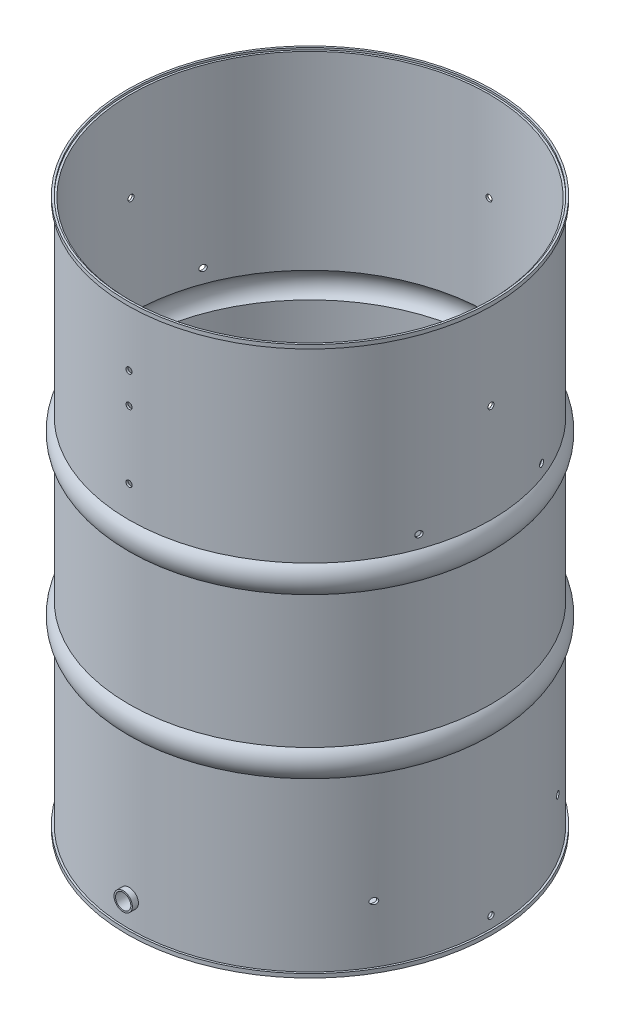
from build123d import *

# Parameters (mm, degrees)
SKETCH2_R                     = 15
BOSS_EXTRUDE1_DEPTH           = 304.8
SKETCH4_R                     = 12.5
AIR_INLET_HOLE_DEPTH          = 303.464
SKETCH5_R                     = 253.021217874
SWEEP_CUT_FOR_AIR_INLET_DEPTH = 76.2
SKETCH6_R                     = 75
COAL_SHUTE_HOLE_DEPTH         = 1181.002884092
WATER_PAN_HOLES_DEPTH         = 1181.002884092
WATER_PAN_HOLES_DEPTH_BACK    = 1181.002884092
SKETCH7_R                     = 5
GRILL_HOLE_1_DEPTH            = 1181.002884092
GRILL_HOLE_1_DEPTH_BACK       = 1181.002884092
SKETCH8_R                     = 5
GRILL_HOLE_2_DEPTH            = 1181.002884092
GRILL_HOLE_2_DEPTH_BACK       = 1181.002884092
SKETCH9_R                     = 5
COAL_BASKET_HOLES_DEPTH       = 1181.002884092
COAL_BASKET_HOLES_DEPTH_BACK  = 1181.002884092
SKETCH10_R                    = 5
AIR_SPREADER_HOLE_DEPTH       = 1181.002884092
AIR_SPREADER_HOLE_DEPTH_BACK  = 1181.002884092
SKETCH11_R                    = 5
SKETCH12_R                    = 5
BRACKET_HOLES_DEPTH           = 1181.002884092


with BuildPart() as part:
    # Sketch1 → Revolve1 (revolve)
    with BuildSketch(Plane.XY, mode=Mode.PRIVATE) as revolve1_sk:
        with BuildLine():
            Line((292.1, 206.565437082), (0, 206.565437082))
            Line((0, 206.565437082), (0, 203.390437082))
            Line((0, 203.390437082), (298.45, 203.390437082))
            Line((298.45, 203.390437082), (298.45, 209.740437082))
            Line((298.45, 209.740437082), (295.275, 209.740437082))
            Line((295.275, 209.740437082), (295.275, 482.790437082))
            ThreePointArc((295.275, 482.790437082), (304.416244366, 504.859353208), (295.275, 526.928269334))
            Line((295.275, 526.928269334), (295.275, 742.828269334))
            ThreePointArc((295.275, 742.828269334), (304.503227722, 765.107181856), (295.275, 787.386094378))
            Line((295.275, 787.386094378), (295.275, 1092.186094378))
            Line((295.275, 1092.186094378), (298.45, 1092.186094378))
            Line((298.45, 1092.186094378), (298.45, 1098.536094378))
            Line((298.45, 1098.536094378), (295.275, 1098.536094378))
            Line((295.275, 1098.536094378), (295.275, 1095.361094378))
            Line((295.275, 1095.361094378), (292.1, 1095.361094378))
            Line((292.1, 1095.361094378), (292.1, 786.029674468))
            ThreePointArc((292.1, 786.029674468), (301.328227722, 765.107181856), (292.1, 744.184689243))
            Line((292.1, 744.184689243), (292.1, 525.571430777))
            ThreePointArc((292.1, 525.571430777), (301.241244366, 504.859353208), (292.1, 484.147275638))
            Line((292.1, 484.147275638), (292.1, 206.565437082))
        make_face()
    revolve(revolve1_sk.sketch.rotate(Axis((0, 1098.536094378, 0), (0, -1, 0)), 270), axis=Axis((0, 1098.536094378, 0), (0, -1, 0)))

    # Sketch2 → Boss-Extrude1 (add)
    with BuildSketch(Plane.XY):
        with Locations(Location((0, 253.390437082, 0), (0, 0, 180))):
            Circle(SKETCH2_R)
    extrude(amount=BOSS_EXTRUDE1_DEPTH)

    # Sketch4 → Air Inlet Hole (cut)
    with BuildSketch(Plane.XY.offset(304.8)):
        with Locations((0, 253.390437082)):
            Circle(SKETCH4_R)
    extrude(amount=-AIR_INLET_HOLE_DEPTH, mode=Mode.SUBTRACT)

    # Sketch5 → Sweep Cut for Air Inlet (cut)
    with BuildSketch(Plane(origin=(0, 206.565437082, 0), x_dir=(1, 0, 0), z_dir=(0, 1, 0))):
        Circle(SKETCH5_R)
    extrude(amount=SWEEP_CUT_FOR_AIR_INLET_DEPTH, mode=Mode.SUBTRACT)

    # Sketch6 → Coal Shute Hole (cut, through all)
    with BuildSketch(Plane.XY):
        with Locations(Location((0, 628.528269334, 0), (0, 0, 270))):
            Circle(SKETCH6_R)
    extrude(amount=-COAL_SHUTE_HOLE_DEPTH, mode=Mode.SUBTRACT)

    # Sketch7 → Water Pan Holes (cut, two sides: drawn at the far end of the back side and taken through both)
    with BuildSketch(Plane(origin=(0, 0, 0), x_dir=(0, 0, -1), z_dir=(1, 0, 0)).offset(-WATER_PAN_HOLES_DEPTH_BACK)):
        with Locations((-99.99867605, 808.536094378)):
            Circle(SKETCH7_R)
        with Locations((100.00132395, 808.536094378)):
            Circle(SKETCH7_R)
    extrude(amount=WATER_PAN_HOLES_DEPTH + WATER_PAN_HOLES_DEPTH_BACK, mode=Mode.SUBTRACT)

    # Sketch8 → Grill Hole 1 (cut, two sides: drawn at the far end of the back side and taken through both)
    with BuildSketch(Plane(origin=(0, 0, 0), x_dir=(0, 0, -1), z_dir=(1, 0, 0)).offset(-GRILL_HOLE_1_DEPTH_BACK)):
        with Locations((0, 948.536094378)):
            Circle(SKETCH8_R)
    extrude(amount=GRILL_HOLE_1_DEPTH + GRILL_HOLE_1_DEPTH_BACK, mode=Mode.SUBTRACT)

    # Sketch9 → Grill Hole 2 (cut, two sides: drawn at the far end of the back side and taken through both)
    with BuildSketch(Plane.XY.offset(-GRILL_HOLE_2_DEPTH_BACK)):
        with Locations((0, 948.536094378)):
            Circle(SKETCH9_R)
    extrude(amount=GRILL_HOLE_2_DEPTH + GRILL_HOLE_2_DEPTH_BACK, mode=Mode.SUBTRACT)

    # Sketch10 → Coal Basket Holes (cut, two sides: drawn at the far end of the back side and taken through both)
    with BuildSketch(Plane(origin=(0, 0, 0), x_dir=(0, 0, -1), z_dir=(1, 0, 0)).offset(-COAL_BASKET_HOLES_DEPTH_BACK)):
        with Locations((150, 303.390437082)):
            Circle(SKETCH10_R)
        with Locations((-150, 303.390437082)):
            Circle(SKETCH10_R)
    extrude(amount=COAL_BASKET_HOLES_DEPTH + COAL_BASKET_HOLES_DEPTH_BACK, mode=Mode.SUBTRACT)

    # Sketch11 → Air Spreader Hole (cut, two sides: drawn at the far end of the back side and taken through both)
    with BuildSketch(Plane(origin=(0, 0, 0), x_dir=(0, 0, -1), z_dir=(1, 0, 0)).offset(-AIR_SPREADER_HOLE_DEPTH_BACK)):
        with Locations((0, 228.390437082)):
            Circle(SKETCH11_R)
    extrude(amount=AIR_SPREADER_HOLE_DEPTH + AIR_SPREADER_HOLE_DEPTH_BACK, mode=Mode.SUBTRACT)

    # Sketch12 → Bracket Holes (cut, through all)
    with BuildSketch(Plane.XY):
        with Locations(Location((0, 838.536094378, 0), (0, 0, 180))):
            Circle(SKETCH12_R)
        with Locations(Location((0, 998.536094378, 0), (0, 0, 180))):
            Circle(SKETCH12_R)
    extrude(amount=BRACKET_HOLES_DEPTH, mode=Mode.SUBTRACT)


solid = part.part
